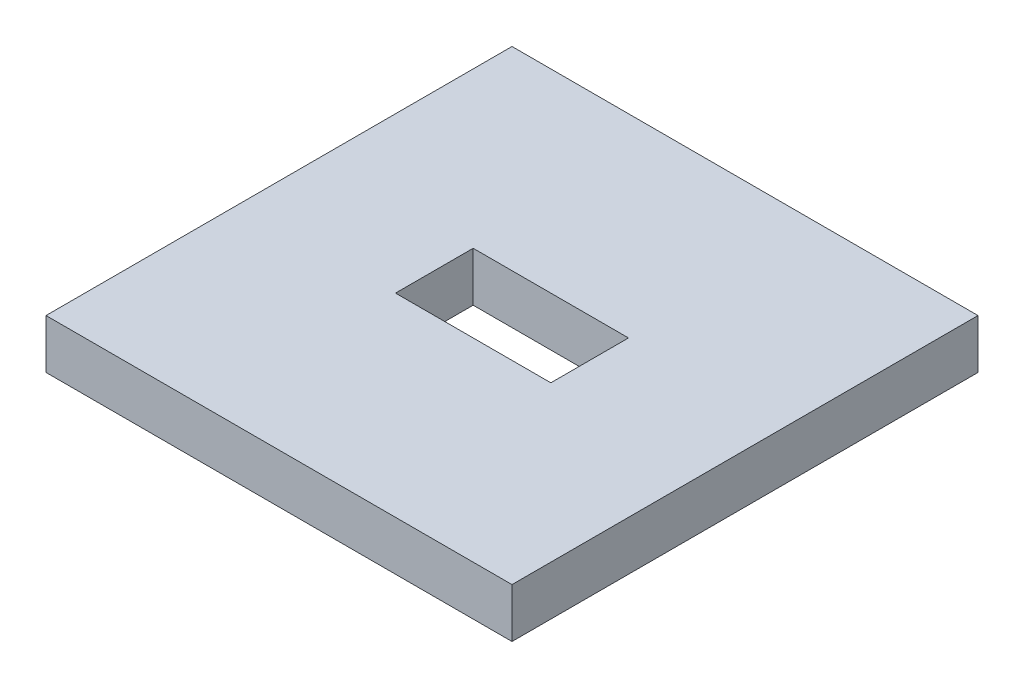
from build123d import *

# Parameters (mm, degrees)
SKETCH1_W           = 60
SKETCH1_H           = 60
SKETCH1_W_2         = 20
SKETCH1_H_2         = 10
BOSS_EXTRUDE1_DEPTH = 6.35


with BuildPart() as part:
    # Sketch1 → Boss-Extrude1 (new body)
    with BuildSketch(Plane(origin=(0, 0, 0), x_dir=(1, 0, 0), z_dir=(0, 1, 0))):
        with Locations((30, 30)):
            Rectangle(SKETCH1_W, SKETCH1_H)
        with Locations((30, 30)):
            Rectangle(SKETCH1_W_2, SKETCH1_H_2, mode=Mode.SUBTRACT)
    extrude(amount=BOSS_EXTRUDE1_DEPTH)


solid = part.part
